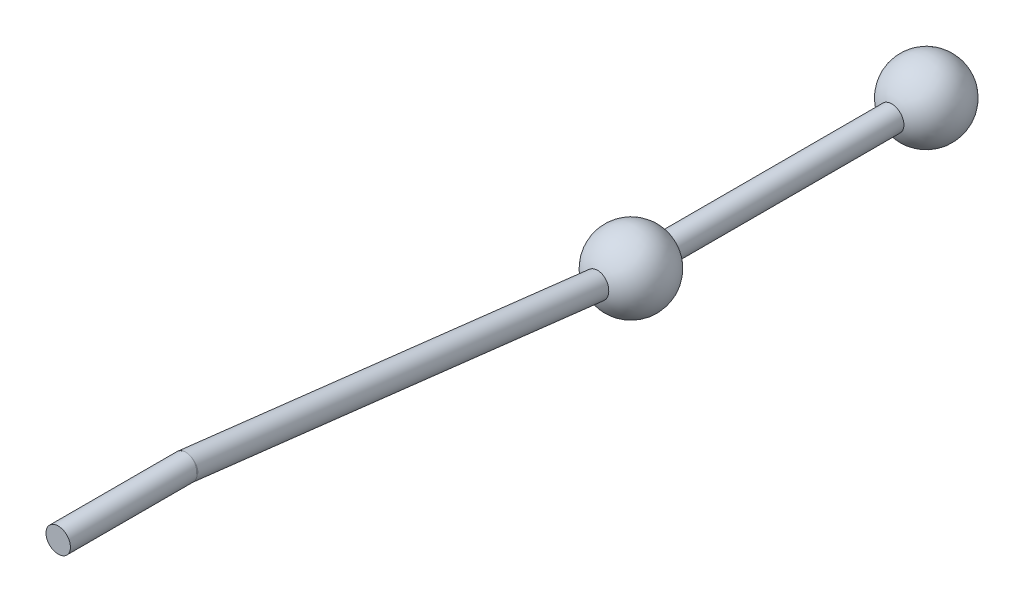
from build123d import *


with BuildPart() as part:
    # Sketch1 → Revolve1 (revolve)
    with BuildSketch(Plane(origin=(0, 0, 0), x_dir=(0, 0, -1), z_dir=(1, 0, 0))):
        with BuildLine():
            Line((-1066.578643763, 50), (-141.421356237, 50))
            ThreePointArc((-141.421356237, 50), (25.365296809, 147.839783948), (150, 0))
            Line((150, 0), (-1358, 0))
            ThreePointArc((-1358, 0), (-1233.365296809, 147.839783948), (-1066.578643763, 50))
        make_face()
    revolve(axis=Axis((0, 0, 1358), (0, 0, -1)))


with BuildPart() as body_2:
    # Sketch2 → Revolve5 (revolve)
    with BuildSketch(Plane(origin=(0, 0, 0), x_dir=(0, 0, -1), z_dir=(1, 0, 0))):
        Polygon((-3550.672621997, 259.30731676), (-3550.672621997, 209.30731676), (-3031.598445104, 209.30731676), (-3028.678638863, 259.30731676), align=None)
    revolve(axis=Axis((0, 209.30731676, 3550.672621997), (0, 0, -1)))


with BuildPart() as part_1:
    add(part.part)

    add(body_2.part)  # Revolve6 merges body 2
    # Sketch2<11> → Revolve6 (revolve)
    with BuildSketch(Plane(origin=(0, 0, 0), x_dir=(0, 0, -1), z_dir=(1, 0, 0))):
        Polygon((-3028.678638863, 259.30731676), (-3031.598445104, 209.30731676), (-1245.576196668, 0), (-1206.418040068, 45.753159355), align=None)
    revolve(axis=Axis((0, 209.30731676, 3031.598445104), (0, -0.11639532908413382, -0.9932029638333729)))


solid = part_1.part
